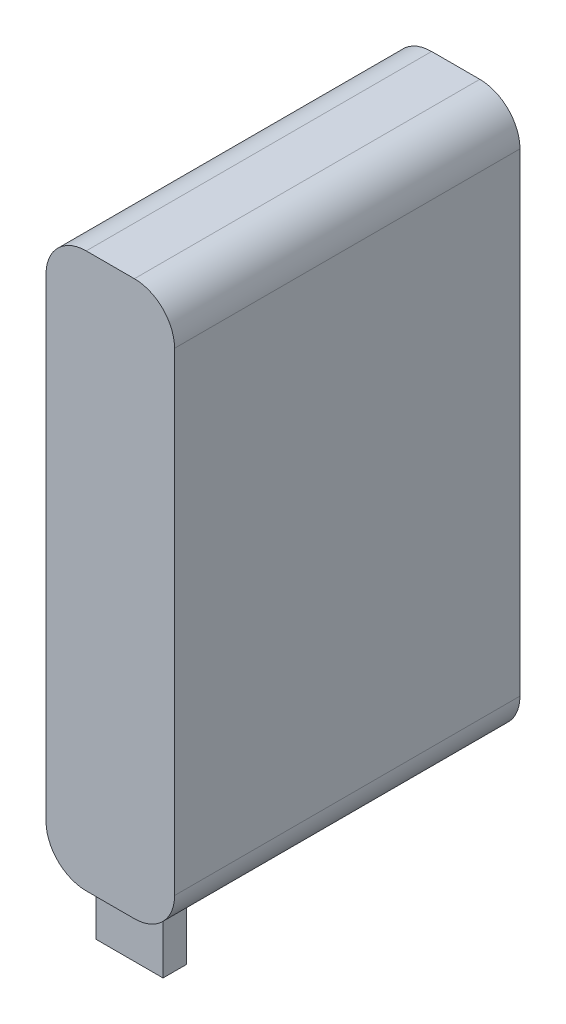
from build123d import *

# Parameters (mm, degrees)
RESSALTO_EXTRUS_O4_DEPTH      = 43
RESSALTO_EXTRUS_O5_DEPTH      = 7
RESSALTO_EXTRUS_O5_DEPTH_BACK = 10
ESBO_O5_W                     = 8.350993052
ESBO_O5_H                     = 2.899650365


with BuildPart() as part:
    # Esboço4 → Ressalto-extrusão4 (new body)
    with BuildSketch(Plane.XY):
        with BuildLine():
            Line((-3, 34.5), (3, 34.5))
            ThreePointArc((3, 34.5), (6.535533906, 33.035533906), (8, 29.5))
            Line((8, 29.5), (8, -29.5))
            ThreePointArc((8, -29.5), (6.535533906, -33.035533906), (3, -34.5))
            Line((3, -34.5), (-3, -34.5))
            ThreePointArc((-3, -34.5), (-6.535533906, -33.035533906), (-8, -29.5))
            Line((-8, -29.5), (-8, 29.5))
            ThreePointArc((-8, 29.5), (-6.535533906, 33.035533906), (-3, 34.5))
        make_face()
    extrude(amount=RESSALTO_EXTRUS_O4_DEPTH)

    # Esboço5 → Ressalto-extrusão5 (add, two sides: drawn at the far end of the back side and taken through both)
    with BuildSketch(Plane.XZ.offset(34.5).offset(-RESSALTO_EXTRUS_O5_DEPTH_BACK)):
        with Locations((0, 39.158870724)):
            Rectangle(ESBO_O5_W, ESBO_O5_H)
    extrude(amount=RESSALTO_EXTRUS_O5_DEPTH + RESSALTO_EXTRUS_O5_DEPTH_BACK)


solid = part.part
